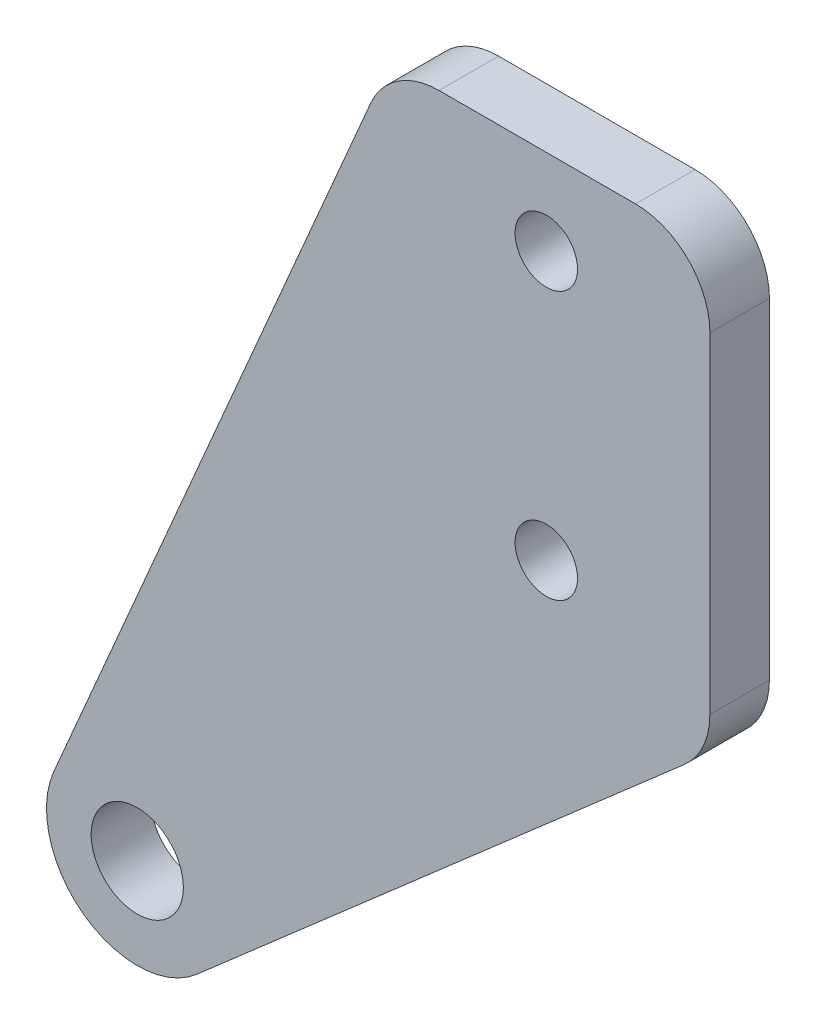
from build123d import *

# Parameters (mm, degrees)
SKETCH_2_R      = 2.1
SKETCH_2_R_2    = 3.1
EXTRUDE_1_DEPTH = 4
FILLET_1_R      = 5


with BuildPart() as part:
    # 草图2 → 凸台-拉伸1 (new body)
    with BuildSketch(Plane.XY):
        with BuildLine():
            Line((-14.5, 14.75), (-37.104267152, -37.841226517))
            ThreePointArc((-37.104267152, -37.841226517), (-35.091941928, -45.180309644), (-27.489316181, -44.846130471))
            Line((-27.489316181, -44.846130471), (7, -14.75))
            Line((7, -14.75), (7, 14.75))
            Line((7, 14.75), (-14.5, 14.75))
        make_face()
        with Locations((-4, 9)):
            Circle(SKETCH_2_R, mode=Mode.SUBTRACT)
        with Locations((-4, -9)):
            Circle(SKETCH_2_R, mode=Mode.SUBTRACT)
        with Locations((-31.5, -40.25)):
            Circle(SKETCH_2_R_2, mode=Mode.SUBTRACT)
    extrude(amount=EXTRUDE_1_DEPTH)

    # 圆角1
    fillet_1_edges = [part.edges().sort_by_distance(p)[0] for p in [
        (-14.5, 14.75, 2),
        (7, 14.75, 2),
        (7, -14.75, 2),
    ]]
    fillet(fillet_1_edges, radius=FILLET_1_R)


solid = part.part
